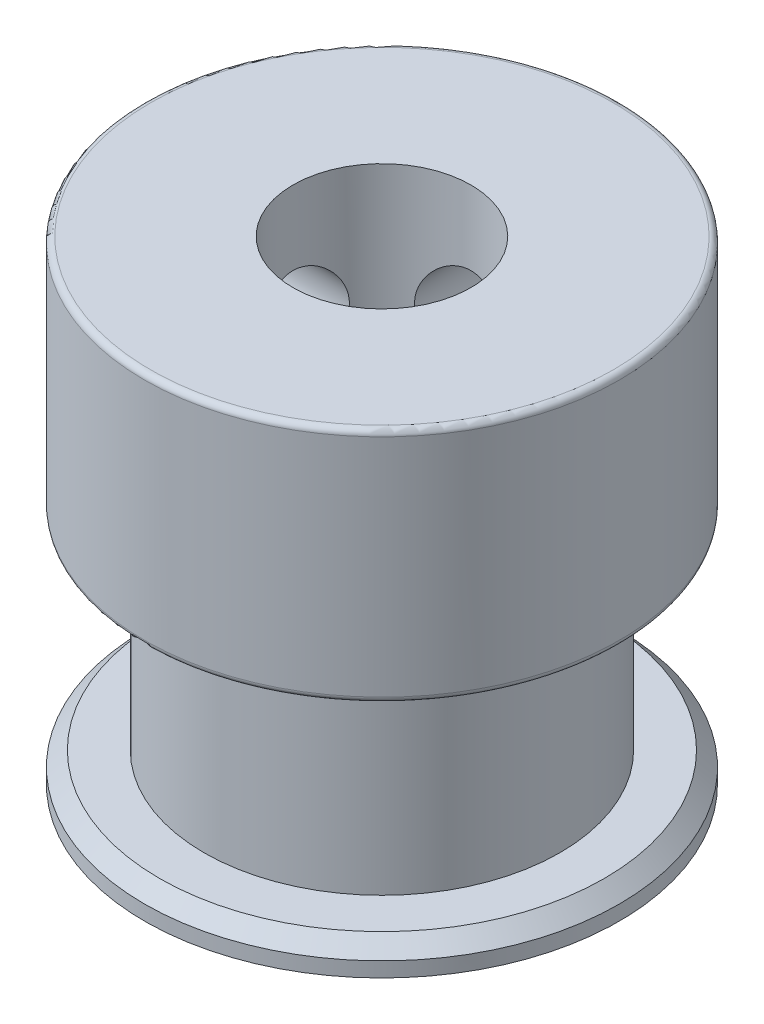
from build123d import *

# Parameters (mm, degrees)
CHAMFER1_SIZE      = 0.5
SKETCH2_R          = 3
CUT_EXTRUDE1_DEPTH = 20.595917942
SKETCH3_R          = 1.5
CUT_EXTRUDE2_DEPTH = 20.595917942
SKETCH4_R          = 1.5
CUT_EXTRUDE3_DEPTH = 20.595918106
FILLET1_R          = 0.2


with BuildPart() as part:
    # Sketch1 → Revolve1 (revolve)
    with BuildSketch(Plane.XY, mode=Mode.PRIVATE) as revolve1_sk:
        Polygon((0, 0), (8, 0), (8, 1), (6, 1), (6, 8), (8, 8), (8, 16), (0, 16), align=None)
    revolve(revolve1_sk.sketch.rotate(Axis((0, 16, 0), (0, -1, 0)), 180), axis=Axis((0, 16, 0), (0, -1, 0)))

    # Chamfer1
    chamfer1_edges = [part.edges().sort_by_distance(p)[0] for p in [
        (8, 1, 0),
    ]]
    chamfer(chamfer1_edges, length=CHAMFER1_SIZE)

    # Sketch2 → Cut-Extrude1 (cut, through all)
    with BuildSketch(Plane(origin=(0, 16, 0), x_dir=(1, 0, 0), z_dir=(0, 1, 0))):
        with Locations(Location((0, 0, 0), (0, 0, 180))):
            Circle(SKETCH2_R)
    extrude(amount=-CUT_EXTRUDE1_DEPTH, mode=Mode.SUBTRACT)

    # Sketch3 → Cut-Extrude2 (cut, through all)
    with BuildSketch(Plane(origin=(0, 0, 0), x_dir=(0, 0, -1), z_dir=(1, 0, 0))):
        with Locations(Location((0, 12, 0), (0, 0, 89.999999999))):
            Circle(SKETCH3_R)
    extrude(amount=-CUT_EXTRUDE2_DEPTH, mode=Mode.SUBTRACT)

    # Sketch4 → Cut-Extrude3 (cut, through all)
    with BuildSketch(Plane.XY):
        with Locations((0, 12)):
            Circle(SKETCH4_R)
    extrude(amount=-CUT_EXTRUDE3_DEPTH, mode=Mode.SUBTRACT)

    # Fillet1
    fillet1_edges = [part.edges().sort_by_distance(p)[0] for p in [
        (8, 16, 0),
        (8, 8, 0),
    ]]
    fillet(fillet1_edges, radius=FILLET1_R)


solid = part.part
